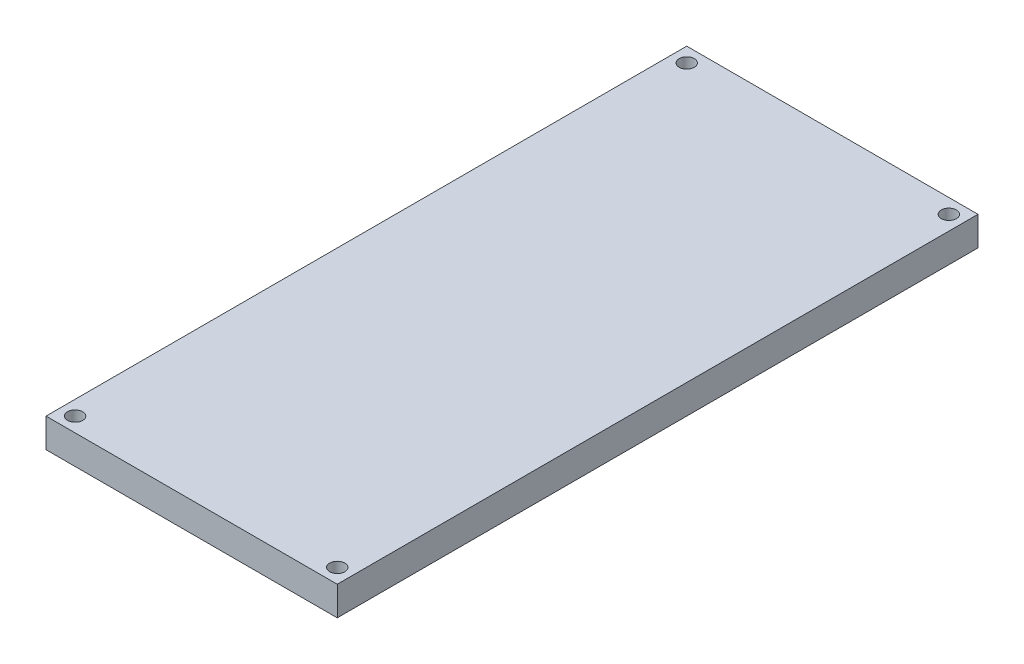
from build123d import *

# Parameters (mm, degrees)
SKETCH1_W           = 63.5
SKETCH1_H           = 139.7
BOSS_EXTRUDE1_DEPTH = 6.35
SKETCH3_R           = 1.65
CUT_EXTRUDE1_DEPTH  = 77.989658396


with BuildPart() as part:
    # Sketch1 → Boss-Extrude1 (new body)
    with BuildSketch(Plane(origin=(0, 0, 0), x_dir=(1, 0, 0), z_dir=(0, 1, 0))):
        Rectangle(SKETCH1_W, SKETCH1_H)
    extrude(amount=BOSS_EXTRUDE1_DEPTH)

    # Sketch3 → Cut-Extrude1 (cut, through all)
    with BuildSketch(Plane(origin=(0, 6.35, 0), x_dir=(1, 0, 0), z_dir=(0, 1, 0))):
        with Locations(Location((28.575, 66.675, 0), (0, 0, 270))):
            Circle(SKETCH3_R)
        with Locations(Location((28.575, -66.675, 0), (0, 0, 270))):
            Circle(SKETCH3_R)
        with Locations(Location((-28.575, -66.675, 0), (0, 0, 270))):
            Circle(SKETCH3_R)
        with Locations(Location((-28.575, 66.675, 0), (0, 0, 270))):
            Circle(SKETCH3_R)
    extrude(amount=-CUT_EXTRUDE1_DEPTH, mode=Mode.SUBTRACT)


solid = part.part
